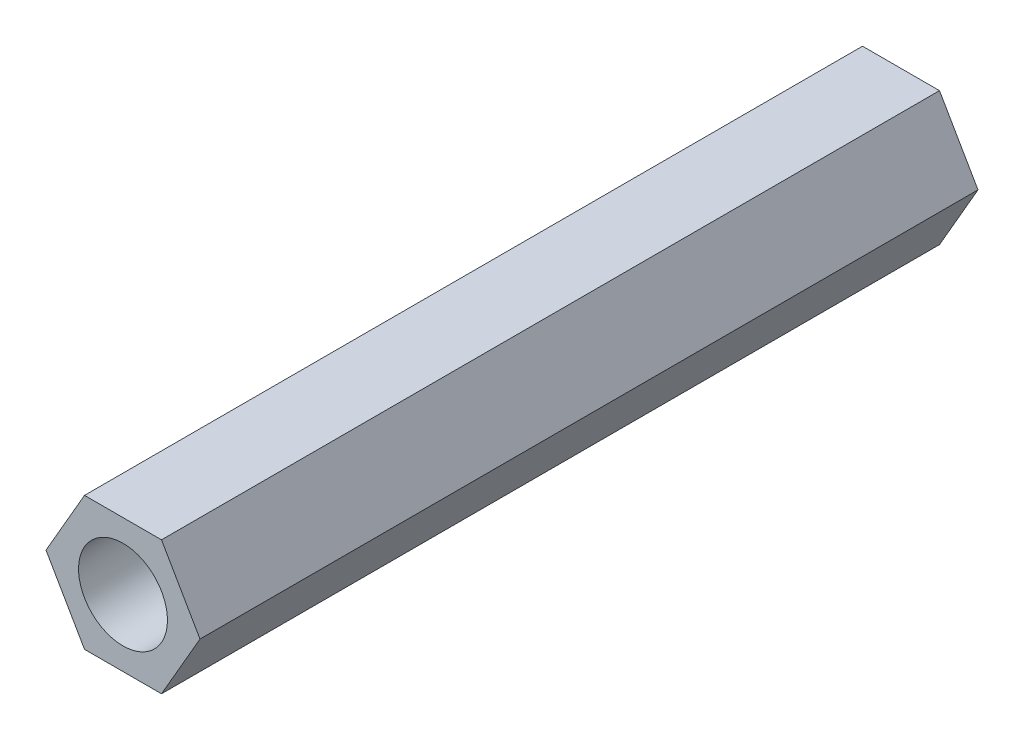
from build123d import *

# Parameters (mm, degrees)
SKETCH_1_R      = 2
EXTRUDE_1_DEPTH = 35


with BuildPart() as part:
    # 草图1 → 凸台-拉伸1 (new body)
    with BuildSketch(Plane.XY):
        Polygon((3.464101615, 0), (1.732050808, 3), (-1.732050808, 3), (-3.464101615, 0), (-1.732050808, -3), (1.732050808, -3), align=None)
        Circle(SKETCH_1_R, mode=Mode.SUBTRACT)
    extrude(amount=EXTRUDE_1_DEPTH)


solid = part.part
